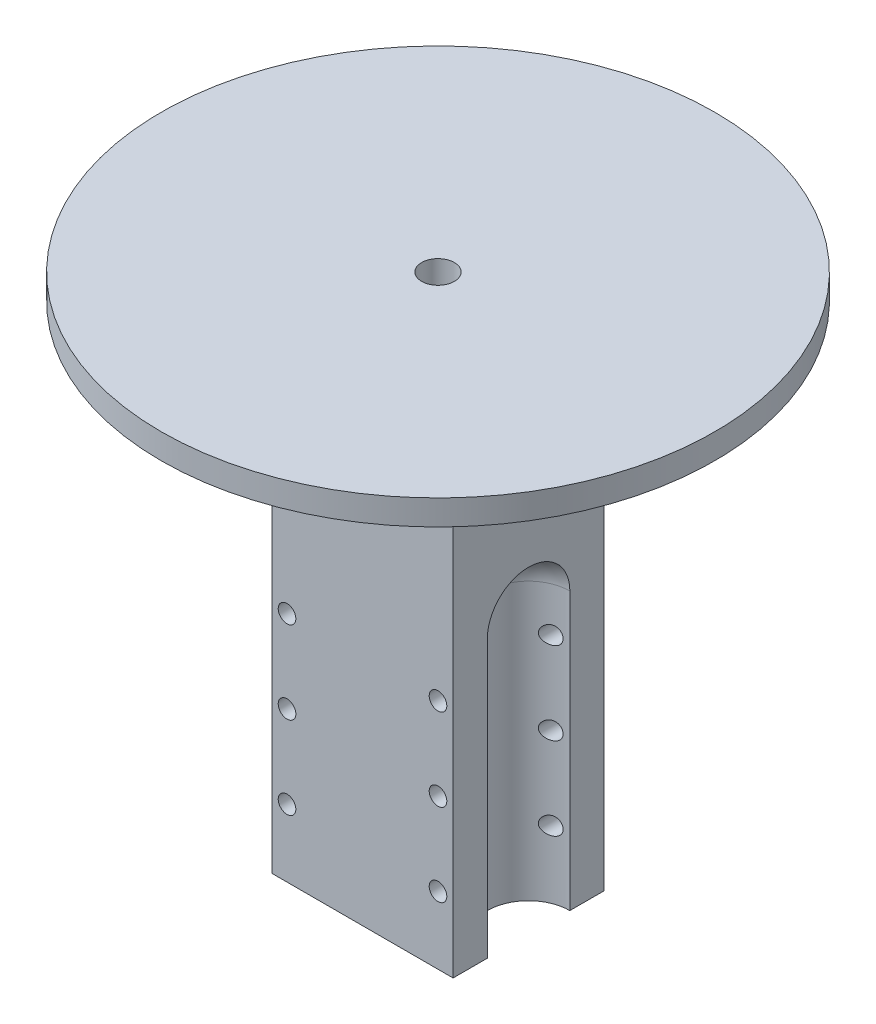
from build123d import *
from build123d.topology import SkipClean

# Parameters (mm, degrees)
SKETCH_5_W                 = 18
SKETCH_5_H                 = 100
EXTRUDE_1_DEPTH            = 15
PATTERN_LINEAR_1_COUNT     = 2
PATTERN_LINEAR_1_PITCH     = 16.1
PATTERN_LINEAR_1_COL_COUNT = 2
PATTERN_LINEAR_1_COL_PITCH = 16.1
SKETCH_9_W                 = 55
SKETCH_9_H                 = 5
CUT_EXTRUDE_1_DEPTH        = 109.050913925
CUT_EXTRUDE_1_DEPTH_BACK   = 109.050913925
SKETCH_12_R                = 3.25
SKETCH_15_R                = 8
CUT_EXTRUDE_4_DEPTH        = 109.050913925
SKETCH_17_W                = 8.2
SKETCH_17_H                = 55
SKETCH_19_R                = 1.75
CUT_EXTRUDE_7_DEPTH        = 109.050913925
PATTERN_LINEAR_2_COUNT     = 3
PATTERN_LINEAR_2_PITCH     = 16.4
MIRROR_7_COPY_1_SKETCH_R   = 1.75
MIRROR_7_COPY_1_DEPTH      = 109.050913925
MIRROR_7_COPY_2_SKETCH_R   = 1.75
MIRROR_7_COPY_2_DEPTH      = 109.050913925
MIRROR_7_COPY_3_SKETCH_R   = 1.75
MIRROR_7_COPY_3_DEPTH      = 109.050913925


with BuildPart() as part:
    # 草图5 → 凸台-拉伸1 (new, symmetric)
    with BuildSketch(Plane.XY):
        with Locations((-9, 20)):
            Rectangle(SKETCH_5_W, SKETCH_5_H)
    extrude_1 = extrude(amount=EXTRUDE_1_DEPTH, both=True)

    # 草图7 → 切除-旋转1 (revolve, cut)
    with BuildSketch(Plane.XY):
        with BuildLine():
            Line((-18, 8), (-18, -8))
            ThreePointArc((-18, -8), (-10, 0), (-18, 8))
        make_face()
    cut_revolve_1 = revolve(axis=Axis((-18, 8, 0), (0, -1, 0)), mode=Mode.SUBTRACT)

    # 阵列(线性)1: 切除-旋转1 ×2
    with Locations(*[(0, i * PATTERN_LINEAR_1_PITCH, 0) for i in range(1, PATTERN_LINEAR_1_COUNT)]):
        add(cut_revolve_1, mode=Mode.SUBTRACT)

    # 阵列(线性)1 col: 切除-旋转1 ×2
    with Locations(*[(0, -i * PATTERN_LINEAR_1_COL_PITCH, 0) for i in range(1, PATTERN_LINEAR_1_COL_COUNT)]):
        add(cut_revolve_1, mode=Mode.SUBTRACT)

    # 镜向2: 凸台-拉伸1 across plane
    add(extrude_1.mirror(Plane(origin=(0, 0, 0), x_dir=(0, 0, 1), z_dir=(1, 0, 0))))

    # 镜向3: 切除-旋转1 across plane
    with SkipClean():  # the faces are left unmerged after this step: merging them gives an invalid solid
        add(cut_revolve_1.mirror(Plane(origin=(0, 0, 0), x_dir=(0, 0, 1), z_dir=(1, 0, 0))), mode=Mode.SUBTRACT)

    # 镜向4 copy 1 sketch → 镜向4 copy 1 (revolve, cut)
    with SkipClean():  # the faces are left unmerged after this step: merging them gives an invalid solid
        with BuildSketch(Plane(origin=(0, 16.1, 0), x_dir=(-1, 0, 0), z_dir=(0, 0, 1))):
            with BuildLine():
                Line((-18, -8), (-18, 8))
                ThreePointArc((-18, 8), (-10, 0), (-18, -8))
            make_face()
        revolve(axis=Axis((18, 24.1, 0), (0, 1, 0)), mode=Mode.SUBTRACT)

    # 镜向4 copy 2 sketch → 镜向4 copy 2 (revolve, cut)
    with SkipClean():  # the faces are left unmerged after this step: merging them gives an invalid solid
        with BuildSketch(Plane(origin=(0, -16.1, 0), x_dir=(-1, 0, 0), z_dir=(0, 0, 1))):
            with BuildLine():
                Line((-18, -8), (-18, 8))
                ThreePointArc((-18, 8), (-10, 0), (-18, -8))
            make_face()
        revolve(axis=Axis((18, -8.1, 0), (0, 1, 0)), mode=Mode.SUBTRACT)

    # 镜向4 copy 3 sketch → 镜向4 copy 3 (revolve, cut)
    with SkipClean():  # the faces are left unmerged after this step: merging them gives an invalid solid
        with BuildSketch(Plane(origin=(0, 0, 0), x_dir=(-1, 0, 0), z_dir=(0, 0, 1))):
            with BuildLine():
                Line((-18, -8), (-18, 8))
                ThreePointArc((-18, 8), (-10, 0), (-18, -8))
            make_face()
        revolve(axis=Axis((18, 8, 0), (0, 1, 0)), mode=Mode.SUBTRACT)

    # 草图9 → 旋转1 (revolve)
    with SkipClean():  # the faces are left unmerged after this step: merging them gives an invalid solid
        with BuildSketch(Plane.XY):
            with Locations((27.5, 72.5)):
                Rectangle(SKETCH_9_W, SKETCH_9_H)
        revolve(axis=Axis((0, 70, 0), (0, 1, 0)))

    # 草图12 → 切除-拉伸1 (cut, two sides: drawn at the far end of the back side and taken through both)
    with SkipClean():  # the faces are left unmerged after this step: merging them gives an invalid solid
        with BuildSketch(Plane(origin=(0, 0, 0), x_dir=(1, 0, 0), z_dir=(0, 1, 0)).offset(-CUT_EXTRUDE_1_DEPTH_BACK)):
            Circle(SKETCH_12_R)
        extrude(amount=CUT_EXTRUDE_1_DEPTH + CUT_EXTRUDE_1_DEPTH_BACK, mode=Mode.SUBTRACT)

    # 草图15 → 切除-拉伸4 (cut, through all)
    with SkipClean():  # the faces are left unmerged after this step: merging them gives an invalid solid
        with BuildSketch(Plane(origin=(0, 0, 0), x_dir=(1, 0, 0), z_dir=(0, 1, 0))):
            Circle(SKETCH_15_R)
        extrude(amount=-CUT_EXTRUDE_4_DEPTH, mode=Mode.SUBTRACT)

    # 草图18 → 切除-旋转2 (revolve, cut)
    with SkipClean():  # the faces are left unmerged after this step: merging them gives an invalid solid
        with BuildSketch(Plane.XY):
            with BuildLine():
                Line((-18, 33.2), (-18, 16.8))
                ThreePointArc((-18, 16.8), (-9.8, 25), (-18, 33.2))
            make_face()
        cut_revolve_2 = revolve(axis=Axis((-18, 33.2, 0), (0, -1, 0)), mode=Mode.SUBTRACT)

    # 草图17 → 切除-旋转3 (revolve, cut)
    with SkipClean():  # the faces are left unmerged after this step: merging them gives an invalid solid
        with BuildSketch(Plane.XY):
            with Locations((-13.9, -2.5)):
                Rectangle(SKETCH_17_W, SKETCH_17_H)
        cut_revolve_3 = revolve(axis=Axis((-18, -30, 0), (0, 1, 0)), mode=Mode.SUBTRACT)

    # 镜向5: 切除-旋转2 across plane
    with SkipClean():  # the faces are left unmerged after this step: merging them gives an invalid solid
        add(cut_revolve_2.mirror(Plane(origin=(0, 0, 0), x_dir=(0, 0, 1), z_dir=(1, 0, 0))), mode=Mode.SUBTRACT)

    # 镜向6: 切除-旋转3 across plane
    with SkipClean():  # the faces are left unmerged after this step: merging them gives an invalid solid
        add(cut_revolve_3.mirror(Plane(origin=(0, 0, 0), x_dir=(0, 0, 1), z_dir=(1, 0, 0))), mode=Mode.SUBTRACT)

    # 草图19 → 切除-拉伸7 (cut, symmetric)
    with SkipClean():  # the faces are left unmerged after this step: merging them gives an invalid solid
        with BuildSketch(Plane.XY):
            with Locations((-15, 16.2)):
                Circle(SKETCH_19_R)
        cut_extrude_7 = extrude(amount=CUT_EXTRUDE_7_DEPTH, both=True, mode=Mode.SUBTRACT)

    # 阵列(线性)2: 切除-拉伸7 ×3
    with SkipClean():  # the faces are left unmerged after this step: merging them gives an invalid solid
        with Locations(*[(0, -i * PATTERN_LINEAR_2_PITCH, 0) for i in range(1, PATTERN_LINEAR_2_COUNT)]):
            add(cut_extrude_7, mode=Mode.SUBTRACT)

    # 镜向7 copy 1 sketch → 镜向7 copy 1 (cut, symmetric)
    with SkipClean():  # the faces are left unmerged after this step: merging them gives an invalid solid
        with BuildSketch(Plane(origin=(0, -16.4, 0), x_dir=(-1, 0, 0), z_dir=(0, 0, 1))):
            with Locations((-15, -16.2)):
                Circle(MIRROR_7_COPY_1_SKETCH_R)
        extrude(amount=MIRROR_7_COPY_1_DEPTH, both=True, mode=Mode.SUBTRACT)

    # 镜向7 copy 2 sketch → 镜向7 copy 2 (cut, symmetric)
    with SkipClean():  # the faces are left unmerged after this step: merging them gives an invalid solid
        with BuildSketch(Plane(origin=(0, -32.8, 0), x_dir=(-1, 0, 0), z_dir=(0, 0, 1))):
            with Locations((-15, -16.2)):
                Circle(MIRROR_7_COPY_2_SKETCH_R)
        extrude(amount=MIRROR_7_COPY_2_DEPTH, both=True, mode=Mode.SUBTRACT)

    # 镜向7 copy 3 sketch → 镜向7 copy 3 (cut, symmetric)
    with SkipClean():  # the faces are left unmerged after this step: merging them gives an invalid solid
        with BuildSketch(Plane(origin=(0, 0, 0), x_dir=(-1, 0, 0), z_dir=(0, 0, 1))):
            with Locations((-15, -16.2)):
                Circle(MIRROR_7_COPY_3_SKETCH_R)
        extrude(amount=MIRROR_7_COPY_3_DEPTH, both=True, mode=Mode.SUBTRACT)


solid = part.part
